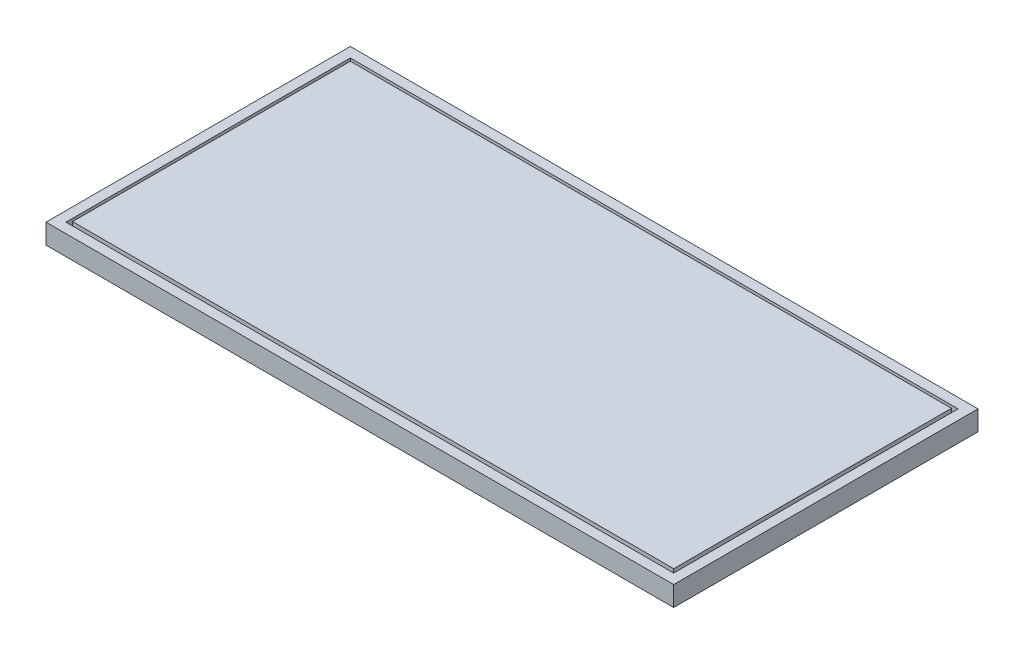
from build123d import *

# Parameters (mm, degrees)
SKETCH1_W                = 92.075
SKETCH1_H                = 42.545
BOSS_EXTRUDE2_DEPTH      = 1.6
BOSS_EXTRUDE4_DEPTH      = 1.524
BOSS_EXTRUDE4_DEPTH_BACK = 1.524
SKETCH2_W                = 96.139
SKETCH2_H                = 46.609
SKETCH2_W_2              = 93.091
SKETCH2_H_2              = 43.561


with BuildPart() as part:
    # Sketch1 → Boss-Extrude2 (new body)
    with BuildSketch(Plane(origin=(0, 0, 0), x_dir=(1, 0, 0), z_dir=(0, 1, 0))):
        Rectangle(SKETCH1_W, SKETCH1_H)
    extrude(amount=BOSS_EXTRUDE2_DEPTH)


with BuildPart() as body_2:
    # Sketch2 → Boss-Extrude4 (new, two sides: drawn at the far end of the back side and taken through both)
    with BuildSketch(Plane.XZ.offset(-BOSS_EXTRUDE4_DEPTH_BACK)):
        Rectangle(SKETCH2_W, SKETCH2_H)
        Rectangle(SKETCH2_W_2, SKETCH2_H_2, mode=Mode.SUBTRACT)
    extrude(amount=BOSS_EXTRUDE4_DEPTH + BOSS_EXTRUDE4_DEPTH_BACK)


solid = Compound([part.part, body_2.part])
